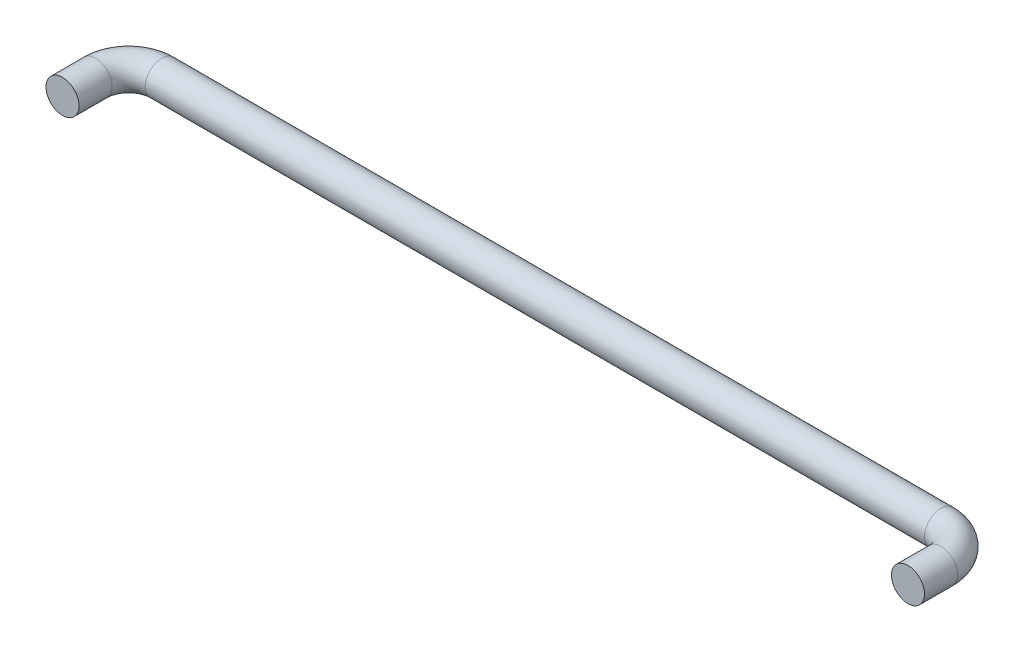
from build123d import *

# Parameters (mm, degrees)
SKETCH2_R = 25


with BuildPart() as part:
    # Sweep1: sweep along a path in Sketch1
    with BuildLine(Plane(origin=(0, 0, 0), x_dir=(1, 0, 0), z_dir=(0, 1, 0))) as sweep1_path:
        Line((0, 0), (0, 50))
        ThreePointArc((0, 50), (14.644660941, 85.355339059), (50, 100))
        Line((50, 100), (1228.6, 100))
        ThreePointArc((1228.6, 100), (1263.955339059, 85.355339059), (1278.6, 50))
        Line((1278.6, 50), (1278.6, 0))
    # Sketch2 → Sweep1 (sweep)
    with BuildSketch(Plane.XY):
        Circle(SKETCH2_R)
    sweep(path=sweep1_path.line)


solid = part.part
